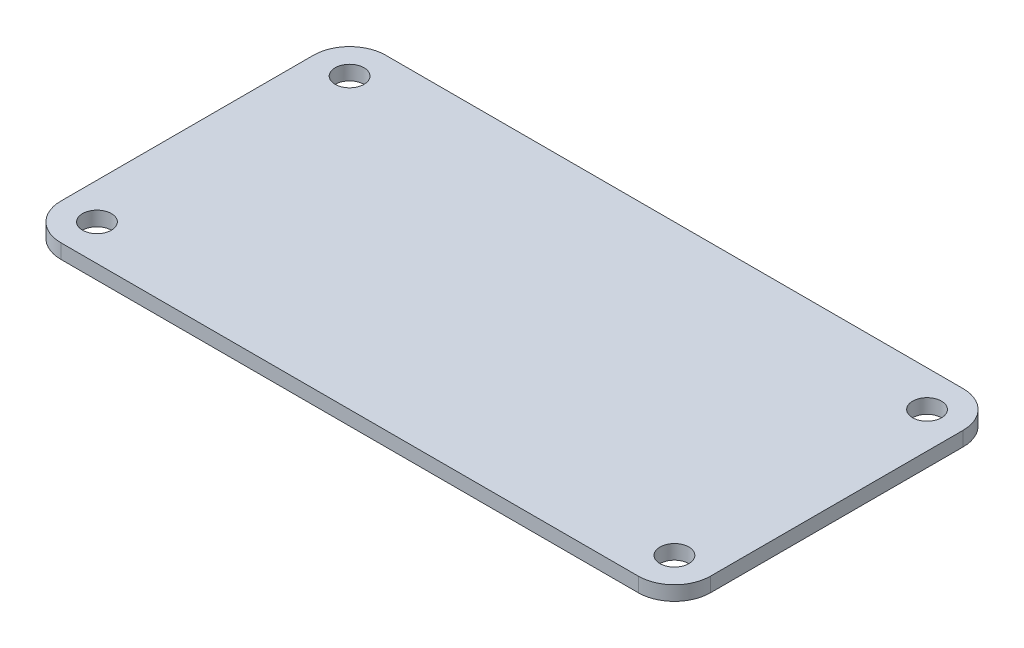
from build123d import *

# Parameters (mm, degrees)
CROQUIS2_W              = 180
CROQUIS2_H              = 90
SALIENTE_EXTRUIR1_DEPTH = 4
REDONDEO1_R             = 10
CORTAR_EXTRUIR2_REACH   = 102.703
CROQUIS4_R              = 4


with BuildPart() as part:
    # Croquis2 → Saliente-Extruir1 (new body)
    with BuildSketch(Plane(origin=(0, 0, 0), x_dir=(1, 0, 0), z_dir=(0, 1, 0))):
        Rectangle(CROQUIS2_W, CROQUIS2_H)
    extrude(amount=SALIENTE_EXTRUIR1_DEPTH)

    # Redondeo1
    redondeo1_edges = [part.edges().sort_by_distance(p)[0] for p in [
        (90, 2, 45),
        (-90, 2, 45),
        (-90, 2, -45),
        (90, 2, -45),
    ]]
    fillet(redondeo1_edges, radius=REDONDEO1_R)

    # Croquis4 → Cortar-Extruir2 (cut, up to next)
    with BuildSketch(Plane(origin=(0, 4, 0), x_dir=(1, 0, 0), z_dir=(0, 1, 0)), mode=Mode.PRIVATE) as cortar_extruir2_sk1:
        with Locations(Location((-80, 35, 0), (0, 0, 270))):
            Circle(CROQUIS4_R)
    cortar_extruir2_tool1 = extrude(cortar_extruir2_sk1.sketch, amount=-CORTAR_EXTRUIR2_REACH, mode=Mode.PRIVATE) & part.part
    # Croquis4 → Cortar-Extruir2 (cut, up to next)
    with BuildSketch(Plane(origin=(0, 4, 0), x_dir=(1, 0, 0), z_dir=(0, 1, 0)), mode=Mode.PRIVATE) as cortar_extruir2_sk2:
        with Locations(Location((-80, -35, 0), (0, 0, 270))):
            Circle(CROQUIS4_R)
    cortar_extruir2_tool2 = extrude(cortar_extruir2_sk2.sketch, amount=-CORTAR_EXTRUIR2_REACH, mode=Mode.PRIVATE) & part.part
    # Croquis4 → Cortar-Extruir2 (cut, up to next)
    with BuildSketch(Plane(origin=(0, 4, 0), x_dir=(1, 0, 0), z_dir=(0, 1, 0)), mode=Mode.PRIVATE) as cortar_extruir2_sk3:
        with Locations(Location((80, -35, 0), (0, 0, 90))):
            Circle(CROQUIS4_R)
    cortar_extruir2_tool3 = extrude(cortar_extruir2_sk3.sketch, amount=-CORTAR_EXTRUIR2_REACH, mode=Mode.PRIVATE) & part.part
    # Croquis4 → Cortar-Extruir2 (cut, up to next)
    with BuildSketch(Plane(origin=(0, 4, 0), x_dir=(1, 0, 0), z_dir=(0, 1, 0)), mode=Mode.PRIVATE) as cortar_extruir2_sk4:
        with Locations(Location((80, 35, 0), (0, 0, 90))):
            Circle(CROQUIS4_R)
    cortar_extruir2_tool4 = extrude(cortar_extruir2_sk4.sketch, amount=-CORTAR_EXTRUIR2_REACH, mode=Mode.PRIVATE) & part.part
    add(cortar_extruir2_tool1.solids().sort_by_distance((-80, 4, -35))[0], mode=Mode.SUBTRACT)
    add(cortar_extruir2_tool2.solids().sort_by_distance((-80, 4, 35))[0], mode=Mode.SUBTRACT)
    add(cortar_extruir2_tool3.solids().sort_by_distance((80, 4, 35))[0], mode=Mode.SUBTRACT)
    add(cortar_extruir2_tool4.solids().sort_by_distance((80, 4, -35))[0], mode=Mode.SUBTRACT)


solid = part.part
